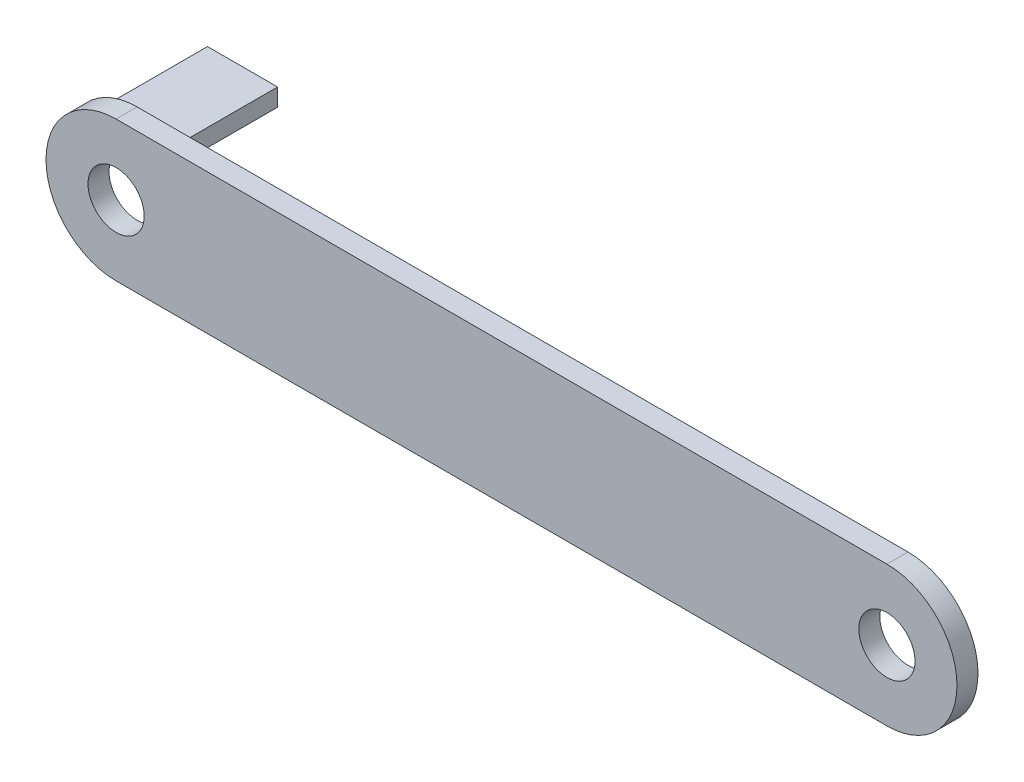
from build123d import *

# Parameters (mm, degrees)
SKETCH1_R           = 4.01
BOSS_EXTRUDE1_DEPTH = 3
SKETCH2_R           = 1.49
BOSS_EXTRUDE3_DEPTH = 4
SKETCH4_W           = 10
SKETCH4_H           = 2.5
BOSS_EXTRUDE5_DEPTH = 15


with BuildPart() as part:
    # Sketch1 → Boss-Extrude1 (new body)
    with BuildSketch(Plane.XY):
        with BuildLine():
            Line((110, 10), (0, 10))
            ThreePointArc((0, 10), (-10, 0), (0, -10))
            Line((0, -10), (110, -10))
            ThreePointArc((110, -10), (120, 0), (110, 10))
        make_face()
        Circle(SKETCH1_R, mode=Mode.SUBTRACT)
        with Locations((110, 0)):
            Circle(SKETCH1_R, mode=Mode.SUBTRACT)
    extrude(amount=BOSS_EXTRUDE1_DEPTH)

    # Sketch2 → Boss-Extrude3 (add)
    with BuildSketch(Plane(origin=(0, 0, 0), x_dir=(-1, 0, 0), z_dir=(0, 0, -1))):
        with Locations(Location((-20, 0, 0), (0, 0, 180))):
            Circle(SKETCH2_R)
    extrude(amount=BOSS_EXTRUDE3_DEPTH)

    # Sketch4 → Boss-Extrude5 (add)
    with BuildSketch(Plane(origin=(0, 0, 0), x_dir=(-1, 0, 0), z_dir=(0, 0, -1))):
        with Locations((-0.046889456, 6.235161972)):
            Rectangle(SKETCH4_W, SKETCH4_H)
    extrude(amount=BOSS_EXTRUDE5_DEPTH)


solid = part.part
